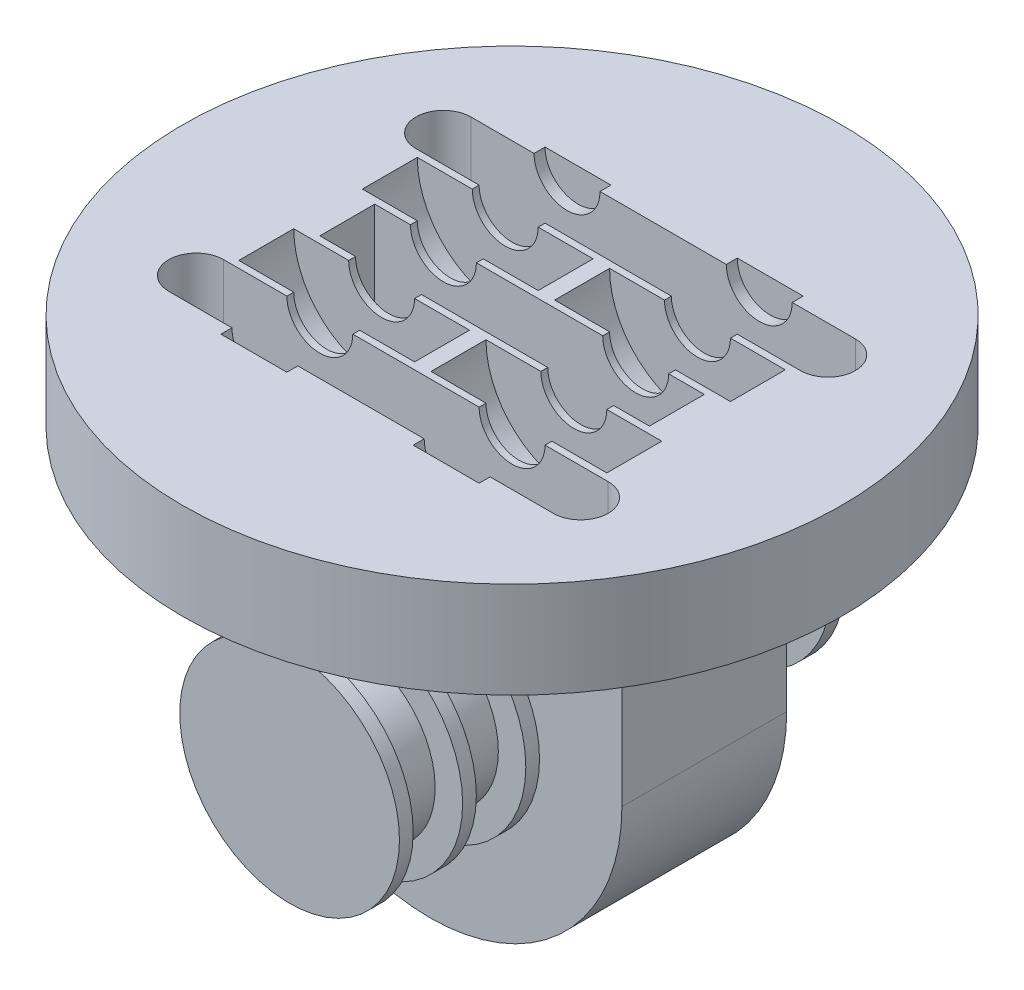
from build123d import *

# Parameters (mm, degrees)
SKETCH2_R               = 60
BOSS_EXTRUDE1_DEPTH     = 35
BOSS_EXTRUDE2_DEPTH     = 15
SKETCH5_R               = 20
BOSS_EXTRUDE3_DEPTH     = 2.5
SKETCH6_R               = 15
BOSS_EXTRUDE4_DEPTH     = 9
BOSS_EXTRUDE5_START     = 2.5
SKETCH7_R               = 20
BOSS_EXTRUDE5_DEPTH     = 2.5
SKETCH8_R               = 15
BOSS_EXTRUDE6_DEPTH     = 9
BOSS_EXTRUDE7_START     = 2.5
SKETCH9_R               = 20
BOSS_EXTRUDE7_DEPTH     = 2.5
CUT_EXTRUDE1_REACH      = 137
SKETCH11_W              = 60
SKETCH11_H              = 10
CUT_EXTRUDE2_DEPTH      = 35
CUT_EXTRUDE3_DEPTH      = 34.5
CUT_EXTRUDE3_DEPTH_BACK = 24.5
SKETCH12_R              = 6
CUT_EXTRUDE4_START      = -17.5
SKETCH15_R              = 60
CUT_EXTRUDE4_DEPTH      = 17.5
SKETCH17_R              = 16
CUT_EXTRUDE6_DEPTH      = 5


with BuildPart() as part:
    # Sketch2 → Boss-Extrude1 (new body)
    with BuildSketch(Plane(origin=(0, 0, 0), x_dir=(1, 0, 0), z_dir=(0, 1, 0))):
        with Locations(Location((0, 0, 0), (0, 0, 270))):
            Circle(SKETCH2_R)
    extrude(amount=BOSS_EXTRUDE1_DEPTH)

    # Sketch4 → Boss-Extrude2 (add, symmetric)
    with BuildSketch(Plane.XY):
        with BuildLine():
            Line((-35, 0), (-35, -35))
            ThreePointArc((-35, -35), (0, -70), (35, -35))
            Line((35, -35), (35, 0))
            Line((35, 0), (-35, 0))
        make_face()
    extrude(amount=BOSS_EXTRUDE2_DEPTH, both=True)

    # Sketch5 → Boss-Extrude3 (add, symmetric)
    with BuildSketch(Plane.XY.offset(15)):
        with Locations((0, -35)):
            Circle(SKETCH5_R)
    boss_extrude3 = extrude(amount=BOSS_EXTRUDE3_DEPTH, both=True)

    # Sketch6 → Boss-Extrude4 (add)
    with BuildSketch(Plane.XY.offset(17.5)):
        with Locations((0, -35)):
            Circle(SKETCH6_R)
    boss_extrude4 = extrude(amount=BOSS_EXTRUDE4_DEPTH)

    # Sketch7 → Boss-Extrude5 (add)
    with BuildSketch(Plane.XY.offset(26.5).offset(BOSS_EXTRUDE5_START)):
        with Locations((0, -35)):
            Circle(SKETCH7_R)
    boss_extrude5 = extrude(amount=-BOSS_EXTRUDE5_DEPTH)

    # Sketch8 → Boss-Extrude6 (add)
    with BuildSketch(Plane.XY.offset(29)):
        with Locations((0, -35)):
            Circle(SKETCH8_R)
    boss_extrude6 = extrude(amount=BOSS_EXTRUDE6_DEPTH)

    # Sketch9 → Boss-Extrude7 (add)
    with BuildSketch(Plane.XY.offset(38).offset(BOSS_EXTRUDE7_START)):
        with Locations((0, -35)):
            Circle(SKETCH9_R)
    boss_extrude7 = extrude(amount=-BOSS_EXTRUDE7_DEPTH)

    # Mirror1: Boss-Extrude3, Boss-Extrude4, Boss-Extrude5, Boss-Extrude6, Boss-Extrude7 across plane
    add(boss_extrude3.mirror(Plane.XY))
    add(boss_extrude4.mirror(Plane.XY))
    add(boss_extrude5.mirror(Plane.XY))
    add(boss_extrude6.mirror(Plane.XY))
    add(boss_extrude7.mirror(Plane.XY))

    # Sketch10 → Cut-Extrude1 (cut, up to next)
    with BuildSketch(Plane(origin=(0, 35, 0), x_dir=(1, 0, 0), z_dir=(0, 1, 0)), mode=Mode.PRIVATE) as cut_extrude1_sk1:
        with BuildLine():
            Line((-35, -17.5), (35, -17.5))
            ThreePointArc((35, -17.5), (40, -22.5), (35, -27.5))
            Line((35, -27.5), (-35, -27.5))
            ThreePointArc((-35, -27.5), (-40, -22.5), (-35, -17.5))
        make_face()
    cut_extrude1_tool1 = extrude(cut_extrude1_sk1.sketch, amount=-CUT_EXTRUDE1_REACH, mode=Mode.PRIVATE) & part.part
    cut_extrude1 = cut_extrude1_tool1.solids().sort_by_distance((0, 35, 22.5))[0]
    add(cut_extrude1, mode=Mode.SUBTRACT)

    # Mirror2: Cut-Extrude1 across plane
    add(cut_extrude1.mirror(Plane.XY), mode=Mode.SUBTRACT)

    # Sketch11 → Cut-Extrude2 (cut)
    with BuildSketch(Plane(origin=(0, 35, 0), x_dir=(1, 0, 0), z_dir=(0, 1, 0))):
        Rectangle(SKETCH11_W, SKETCH11_H)
    extrude(amount=-CUT_EXTRUDE2_DEPTH, mode=Mode.SUBTRACT)

    # Sketch12 → Cut-Extrude3 (cut, two sides: drawn at the far end of the back side and taken through both)
    with BuildSketch(Plane.XY.offset(-5).offset(-CUT_EXTRUDE3_DEPTH_BACK)):
        with Locations(Location((-17.5, 17.5, 0), (0, 0, 180))):
            Circle(SKETCH12_R)
        with Locations(Location((17.5, 17.5, 0), (0, 0, 180))):
            Circle(SKETCH12_R)
    extrude(amount=CUT_EXTRUDE3_DEPTH + CUT_EXTRUDE3_DEPTH_BACK, mode=Mode.SUBTRACT)

    # Sketch15 → Cut-Extrude4 (cut)
    with BuildSketch(Plane(origin=(0, 35, 0), x_dir=(1, 0, 0), z_dir=(0, 1, 0)).offset(CUT_EXTRUDE4_START)):
        with Locations(Location((0, 0, 0), (0, 0, 270))):
            Circle(SKETCH15_R)
    extrude(amount=CUT_EXTRUDE4_DEPTH, mode=Mode.SUBTRACT)

    # Sketch17 → Cut-Extrude6 (cut, symmetric)
    with BuildSketch(Plane.XY.offset(-11.25)):
        with Locations((-17.5, 17.5)):
            Circle(SKETCH17_R)
        with Locations((17.5, 17.5)):
            Circle(SKETCH17_R)
    cut_extrude6 = extrude(amount=CUT_EXTRUDE6_DEPTH, both=True, mode=Mode.SUBTRACT)

    # Mirror3: Cut-Extrude6 across plane
    add(cut_extrude6.mirror(Plane.XY), mode=Mode.SUBTRACT)


solid = part.part
